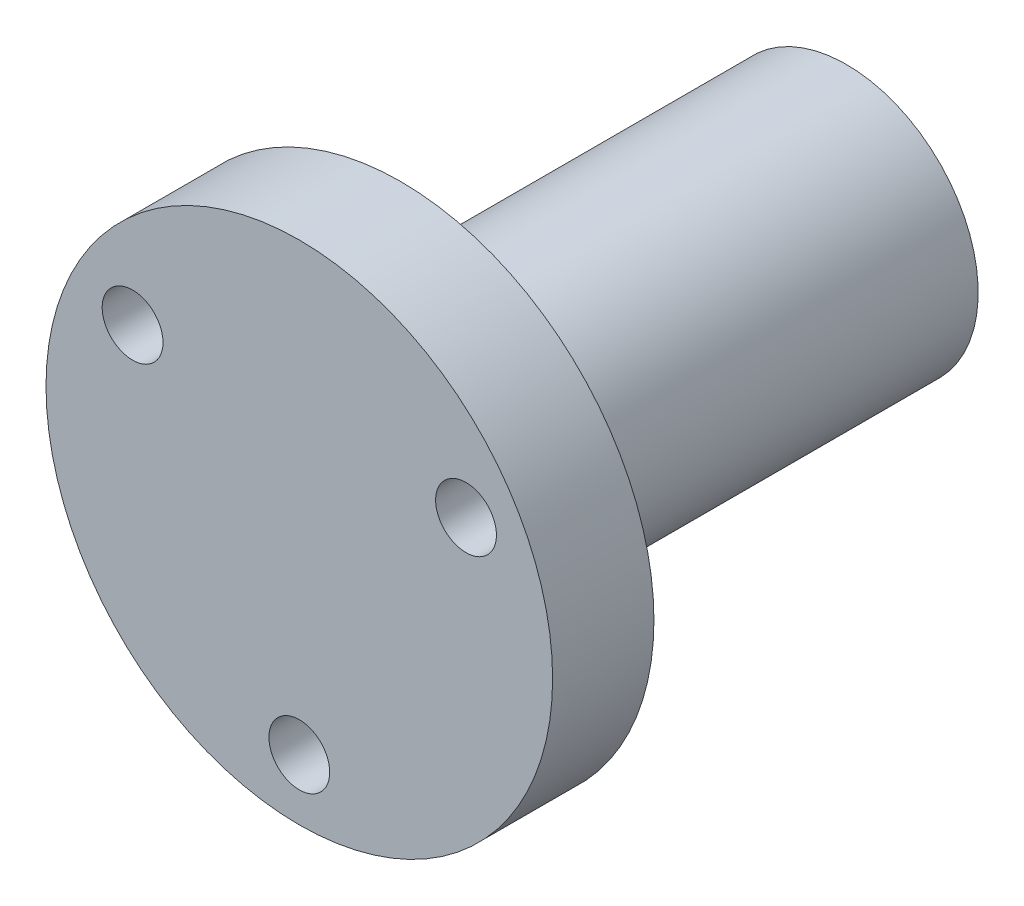
from build123d import *

# Parameters (mm, degrees)
SKETCH1_R           = 12.5
BOSS_EXTRUDE1_DEPTH = 5
SKETCH2_R           = 6.5
BOSS_EXTRUDE2_DEPTH = 22
CUT_EXTRUDE1_DEPTH  = 22
CUT_EXTRUDE2_REACH  = 34.272
SKETCH4_R           = 1.5


with BuildPart() as part:
    # Sketch1 → Boss-Extrude1 (new body)
    with BuildSketch(Plane.XY):
        Circle(SKETCH1_R)
    extrude(amount=-BOSS_EXTRUDE1_DEPTH)

    # Sketch2 → Boss-Extrude2 (add)
    with BuildSketch(Plane(origin=(0, 0, -5), x_dir=(-1, 0, 0), z_dir=(0, 0, -1))):
        Circle(SKETCH2_R)
    extrude(amount=BOSS_EXTRUDE2_DEPTH)

    # Sketch3 → Cut-Extrude1 (cut)
    with BuildSketch(Plane(origin=(0, 0, -27), x_dir=(-1, 0, 0), z_dir=(0, 0, -1))):
        with BuildLine():
            Line((-1.766352173, -2.3), (1.766352173, -2.3))
            ThreePointArc((1.766352173, -2.3), (0, 2.9), (-1.766352173, -2.3))
        make_face()
    extrude(amount=-CUT_EXTRUDE1_DEPTH, mode=Mode.SUBTRACT)

    # Sketch4 → Cut-Extrude2 (cut, up to next)
    with BuildSketch(Plane.XY, mode=Mode.PRIVATE) as cut_extrude2_sk1:
        with Locations((-8.227241336, 4.75)):
            Circle(SKETCH4_R)
    cut_extrude2_tool1 = extrude(cut_extrude2_sk1.sketch, amount=-CUT_EXTRUDE2_REACH, mode=Mode.PRIVATE) & part.part
    # Sketch4 → Cut-Extrude2 (cut, up to next)
    with BuildSketch(Plane.XY, mode=Mode.PRIVATE) as cut_extrude2_sk2:
        with Locations((8.227241336, 4.75)):
            Circle(SKETCH4_R)
    cut_extrude2_tool2 = extrude(cut_extrude2_sk2.sketch, amount=-CUT_EXTRUDE2_REACH, mode=Mode.PRIVATE) & part.part
    # Sketch4 → Cut-Extrude2 (cut, up to next)
    with BuildSketch(Plane.XY, mode=Mode.PRIVATE) as cut_extrude2_sk3:
        with Locations((0, -9.5)):
            Circle(SKETCH4_R)
    cut_extrude2_tool3 = extrude(cut_extrude2_sk3.sketch, amount=-CUT_EXTRUDE2_REACH, mode=Mode.PRIVATE) & part.part
    add(cut_extrude2_tool1.solids().sort_by_distance((-8.227241, 4.75, 0))[0], mode=Mode.SUBTRACT)
    add(cut_extrude2_tool2.solids().sort_by_distance((8.227241, 4.75, 0))[0], mode=Mode.SUBTRACT)
    add(cut_extrude2_tool3.solids().sort_by_distance((0, -9.5, 0))[0], mode=Mode.SUBTRACT)


solid = part.part
